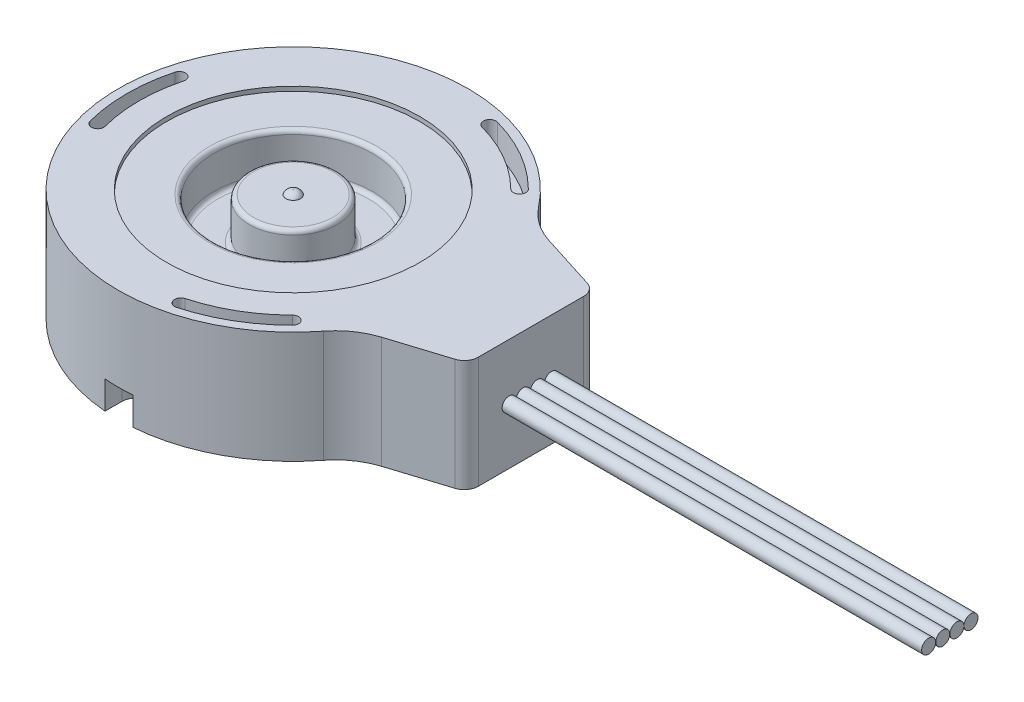
from build123d import *

# Parameters (mm, degrees)
BOSS_EXTRUDE1_DEPTH     = 8
CUT_EXTRUDE1_DEPTH      = 2
CUT_EXTRUDE2_DEPTH      = 1
CUT_EXTRUDE2_DEPTH_BACK = 1
SKETCH7_R               = 0.5
BOSS_EXTRUDE4_DEPTH     = 30
CUT_EXTRUDE3_DEPTH      = 2


with BuildPart() as part:
    # Sketch1 → Boss-Extrude1 (new body)
    with BuildSketch(Plane(origin=(0, 0, 0), x_dir=(1, 0, 0), z_dir=(0, 1, 0))):
        with BuildLine():
            Line((12.297414328, 5.987472362), (16.301582158, 4.720916174))
            ThreePointArc((16.301582158, 4.720916174), (16.806716232, 4.358414998), (17, 3.767475981))
            Line((17, 3.767475981), (17, -3.767475981))
            ThreePointArc((17, -3.767475981), (16.806716232, -4.358414998), (16.301582158, -4.720916174))
            Line((16.301582158, -4.720916174), (12.297414328, -5.987472362))
            ThreePointArc((12.297414328, -5.987472362), (10.950566944, -6.649754843), (9.860946513, -7.68190952))
            ThreePointArc((9.860946513, -7.68190952), (-12.5, 0), (9.860946513, 7.68190952))
            ThreePointArc((9.860946513, 7.68190952), (10.950566944, 6.649754843), (12.297414328, 5.987472362))
        make_face()
    extrude(amount=BOSS_EXTRUDE1_DEPTH)

    # Sketch2 → Cut-Extrude1 (cut)
    with BuildSketch(Plane.XZ):
        with BuildLine():
            Line((1, 11.25), (1, 12.459935794))
            ThreePointArc((1, 12.459935794), (0, 12.5), (-1, 12.459935794))
            Line((-1, 12.459935794), (-1, 11.25))
            ThreePointArc((-1, 11.25), (0, 10.25), (1, 11.25))
        make_face()
        with BuildLine():
            Line((-11.25, -1), (-12.459935794, -1))
            ThreePointArc((-12.459935794, -1), (-12.5, 0), (-12.459935794, 1))
            Line((-12.459935794, 1), (-11.25, 1))
            ThreePointArc((-11.25, 1), (-10.25, 0), (-11.25, -1))
        make_face()
        with BuildLine():
            Line((1, -11.25), (1, -12.459935794))
            ThreePointArc((1, -12.459935794), (0, -12.5), (-1, -12.459935794))
            Line((-1, -12.459935794), (-1, -11.25))
            ThreePointArc((-1, -11.25), (0, -10.25), (1, -11.25))
        make_face()
    extrude(amount=-CUT_EXTRUDE1_DEPTH, mode=Mode.SUBTRACT)

    # Sketch3 → Cut-Extrude2 (cut, two sides: drawn at the far end of the back side and taken through both)
    with BuildSketch(Plane.XY.offset(-CUT_EXTRUDE2_DEPTH_BACK)):
        with BuildLine():
            Line((16, 0), (14.339588828, 3.617029189))
            ThreePointArc((14.339588828, 3.617029189), (14.248707164, 3.675309612), (14.1578255, 3.617029189))
            Line((14.1578255, 3.617029189), (12.497414328, 0))
            Line((12.497414328, 0), (16, 0))
        make_face()
    extrude(amount=CUT_EXTRUDE2_DEPTH + CUT_EXTRUDE2_DEPTH_BACK, mode=Mode.SUBTRACT)

    # Sketch6 → Cut-Revolve3 (revolve, cut)
    with BuildSketch(Plane.XY):
        with BuildLine():
            Line((-9.049917084, 8), (-0.023760171, 8))
            ThreePointArc((-0.023760171, 8), (-0.315220074, 7.915431347), (-0.516149554, 7.687993274))
            Line((-0.516149554, 7.687993274), (-2.834306132, 7.687993274))
            ThreePointArc((-2.834306132, 7.687993274), (-3.046438167, 7.600125308), (-3.134306132, 7.387993274))
            Line((-3.134306132, 7.387993274), (-3.134306132, 5.033771489))
            ThreePointArc((-3.134306132, 5.033771489), (-3.222174098, 4.821639455), (-3.434306132, 4.733771489))
            Line((-3.434306132, 4.733771489), (-5.381583428, 4.733771489))
            ThreePointArc((-5.381583428, 4.733771489), (-5.593715462, 4.821639455), (-5.681583428, 5.033771489))
            Line((-5.681583428, 5.033771489), (-5.681583428, 7.387993274))
            ThreePointArc((-5.681583428, 7.387993274), (-5.769451393, 7.600125308), (-5.981583428, 7.687993274))
            Line((-5.981583428, 7.687993274), (-9.049917084, 7.687993274))
            Line((-9.049917084, 7.687993274), (-9.049917084, 8))
        make_face()
    revolve(axis=Axis((0, 0, 0), (0, 1, 0)), mode=Mode.SUBTRACT)

    # Sketch7 → Boss-Extrude4 (add)
    with BuildSketch(Plane(origin=(17, 0, 0), x_dir=(0, 0, -1), z_dir=(1, 0, 0))):
        with Locations((-1.563421987, 4)):
            Circle(SKETCH7_R)
        with Locations((-0.553421987, 4)):
            Circle(SKETCH7_R)
        with Locations((0.456578013, 4)):
            Circle(SKETCH7_R)
        with Locations((1.466578013, 4)):
            Circle(SKETCH7_R)
    extrude(amount=BOSS_EXTRUDE4_DEPTH)

    # Sketch8 → Cut-Extrude3 (cut)
    with BuildSketch(Plane(origin=(0, 8, 0), x_dir=(1, 0, 0), z_dir=(0, 1, 0))):
        with BuildLine():
            ThreePointArc((-11.496633178, -3.033982251), (-11.890232168, -0.001304237), (-11.497298495, 3.031460051))
            ThreePointArc((-11.497298495, 3.031460051), (-10.953844404, 3.348128163), (-10.637176292, 2.804674072))
            ThreePointArc((-10.637176292, 2.804674072), (-11.000714274, 0.001254503), (-10.637815696, -2.802247907))
            ThreePointArc((-10.637815696, -2.802247907), (-10.951370221, -3.347475805), (-11.496633178, -3.033982251))
        make_face()
        with BuildLine():
            ThreePointArc((3.120810885, 11.473367515), (5.943986582, 10.297895233), (8.373970662, 8.441222546))
            ThreePointArc((8.373970662, 8.441222546), (8.376486246, 7.812243441), (7.747507142, 7.809727858))
            ThreePointArc((7.747507142, 7.809727858), (5.501443569, 9.52627077), (2.892089973, 10.613742587))
            ThreePointArc((2.892089973, 10.613742587), (2.576686025, 11.15790272), (3.120810885, 11.473367515))
        make_face()
        with BuildLine():
            ThreePointArc((8.375822292, -8.439385265), (5.946245587, -10.296590996), (3.123327833, -11.472682597))
            ThreePointArc((3.123327833, -11.472682597), (2.577358158, -11.160371604), (2.889669151, -10.614401929))
            ThreePointArc((2.889669151, -10.614401929), (5.499270705, -9.527525273), (7.745725723, -7.81149468))
            ThreePointArc((7.745725723, -7.81149468), (8.374684196, -7.810426915), (8.375822292, -8.439385265))
        make_face()
    extrude(amount=-CUT_EXTRUDE3_DEPTH, mode=Mode.SUBTRACT)


solid = part.part
